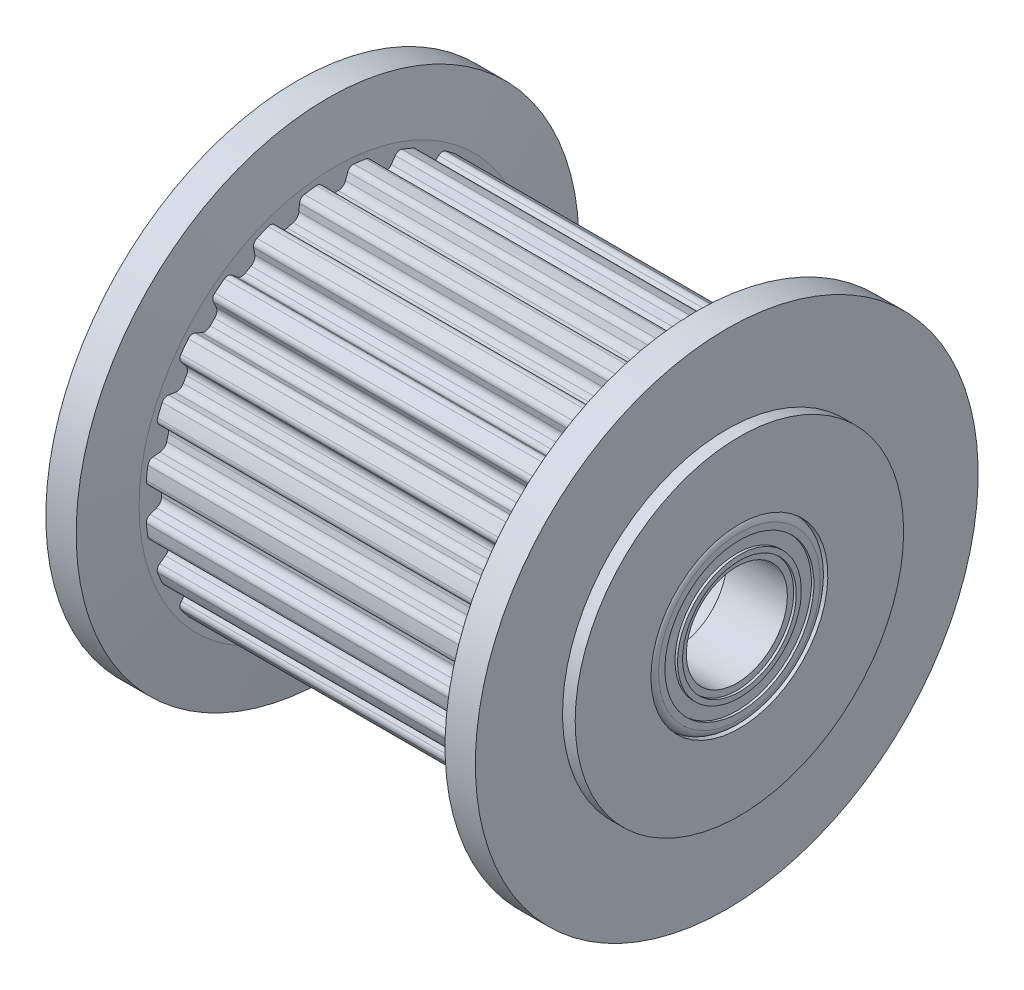
from build123d import *

# Parameters (mm, degrees)
CUT_EXTRUDE_1_DEPTH              = 20.204171422
FILLET_1_R                       = 0.3
FILLET_2_R                       = 0.23
PATTERN_CIRCULAR_1_COUNT         = 24
FILLET_1_OF_PATTERN_CIRCULAR_1_R = 0.3
FILLET_2_OF_PATTERN_CIRCULAR_1_R = 0.23
SKETCH_8_R                       = 2
CUT_EXTRUDE_3_DEPTH              = 23.847428739
SKETCH_9_W                       = 0.1
SKETCH_9_H                       = 0.5


with BuildPart() as part:
    # 草图1 → 旋转1 (revolve)
    with BuildSketch(Plane.XY, mode=Mode.PRIVATE) as revolve_1_sk:
        Polygon((-9, 0), (-9, 6.5), (-7, 6.5), (-7, 7.51), (7, 7.51), (7, 6.5), (9, 6.5), (9, 0), align=None)
    revolve(revolve_1_sk.sketch.rotate(Axis((9, 0, 0), (-1, 0, 0)), 90), axis=Axis((9, 0, 0), (-1, 0, 0)))

    # 草图3 → 切除-拉伸1 (cut, through all)
    with BuildSketch(Plane.ZY.offset(7)):
        with BuildLine():
            Line((-0.563217845, 7.488850757), (-0.335, 6.861827381))
            ThreePointArc((-0.335, 6.861827381), (0, 6.87), (0.335, 6.861827381))
            Line((0.335, 6.861827381), (0.563217845, 7.488850757))
            ThreePointArc((0.563217845, 7.488850757), (0, 7.51), (-0.563217845, 7.488850757))
        make_face()
    cut_extrude_1 = extrude(amount=-CUT_EXTRUDE_1_DEPTH, mode=Mode.SUBTRACT)

    # 圆角1
    fillet_1_edges = [part.edges().sort_by_distance(p)[0] for p in [
        (0, 6.861827381, 0.335),
        (0, 6.861827381, -0.335),
    ]]
    fillet(fillet_1_edges, radius=FILLET_1_R)

    # 圆角2
    fillet_2_edges = [part.edges().sort_by_distance(p)[0] for p in [
        (0, 7.488850757, -0.563217845),
        (0, 7.488850757, 0.563217845),
    ]]
    fillet(fillet_2_edges, radius=FILLET_2_R)

    # 阵列(圆周)1: 切除-拉伸1 ×24 about axis
    pattern_circular_1_axis = Axis((0, 0, 0), (1, 0, 0))
    for i in range(1, PATTERN_CIRCULAR_1_COUNT):
        add(cut_extrude_1.rotate(pattern_circular_1_axis, i * 360 / PATTERN_CIRCULAR_1_COUNT), mode=Mode.SUBTRACT)

    # 圆角1 of 阵列(圆周)1
    fillet_1_of_pattern_circular_1_edges = [part.edges().sort_by_distance(p)[0] for p in [
        (0, 6.541311902, 2.099556762),
        (0, 6.714720662, 1.452386458),
        (0, 5.775016828, 3.721032201),
        (0, 6.110016828, 3.14079518),
        (0, 4.6151639, 5.088925444),
        (0, 5.088925444, 4.6151639),
        (0, 3.14079518, 6.110016828),
        (0, 3.721032201, 5.775016828),
        (0, 1.452386458, 6.714720662),
        (0, 2.099556762, 6.541311902),
        (0, -0.335, 6.861827381),
        (0, 0.335, 6.861827381),
        (0, -2.099556762, 6.541311902),
        (0, -1.452386458, 6.714720662),
        (0, -3.721032201, 5.775016828),
        (0, -3.14079518, 6.110016828),
        (0, -5.088925444, 4.6151639),
        (0, -4.6151639, 5.088925444),
        (0, -6.110016828, 3.14079518),
        (0, -5.775016828, 3.721032201),
        (0, -6.714720662, 1.452386458),
        (0, -6.541311902, 2.099556762),
        (0, -6.861827381, -0.335),
        (0, -6.861827381, 0.335),
        (0, -6.541311902, -2.099556762),
        (0, -6.714720662, -1.452386458),
        (0, -5.775016828, -3.721032201),
        (0, -6.110016828, -3.14079518),
        (0, -4.6151639, -5.088925444),
        (0, -5.088925444, -4.6151639),
        (0, -3.14079518, -6.110016828),
        (0, -3.721032201, -5.775016828),
        (0, -1.452386458, -6.714720662),
        (0, -2.099556762, -6.541311902),
        (0, 0.335, -6.861827381),
        (0, -0.335, -6.861827381),
        (0, 2.099556762, -6.541311902),
        (0, 1.452386458, -6.714720662),
        (0, 3.721032201, -5.775016828),
        (0, 3.14079518, -6.110016828),
        (0, 5.088925444, -4.6151639),
        (0, 4.6151639, -5.088925444),
        (0, 6.110016828, -3.14079518),
        (0, 5.775016828, -3.721032201),
        (0, 6.714720662, -1.452386458),
        (0, 6.541311902, -2.099556762),
    ]]
    fillet(fillet_1_of_pattern_circular_1_edges, radius=FILLET_1_OF_PATTERN_CIRCULAR_1_R)

    # 圆角2 of 阵列(圆周)1
    fillet_2_of_pattern_circular_1_edges = [part.edges().sort_by_distance(p)[0] for p in [
        (0, 7.37944586, 1.394230539),
        (0, 7.08790285, 2.482283864),
        (0, 6.767143923, 3.256664417),
        (0, 6.203926078, 4.23218634),
        (0, 5.693672311, 4.897161996),
        (0, 4.897161996, 5.693672311),
        (0, 4.23218634, 6.203926078),
        (0, 3.256664417, 6.767143923),
        (0, 2.482283864, 7.08790285),
        (0, 1.394230539, 7.37944586),
        (0, 0.563217845, 7.488850757),
        (0, -0.563217845, 7.488850757),
        (0, -1.394230539, 7.37944586),
        (0, -2.482283864, 7.08790285),
        (0, -3.256664417, 6.767143923),
        (0, -4.23218634, 6.203926078),
        (0, -4.897161996, 5.693672311),
        (0, -5.693672311, 4.897161996),
        (0, -6.203926078, 4.23218634),
        (0, -6.767143923, 3.256664417),
        (0, -7.08790285, 2.482283864),
        (0, -7.37944586, 1.394230539),
        (0, -7.488850757, 0.563217845),
        (0, -7.488850757, -0.563217845),
        (0, -7.37944586, -1.394230539),
        (0, -7.08790285, -2.482283864),
        (0, -6.767143923, -3.256664417),
        (0, -6.203926078, -4.23218634),
        (0, -5.693672311, -4.897161996),
        (0, -4.897161996, -5.693672311),
        (0, -4.23218634, -6.203926078),
        (0, -3.256664417, -6.767143923),
        (0, -2.482283864, -7.08790285),
        (0, -1.394230539, -7.37944586),
        (0, -0.563217845, -7.488850757),
        (0, 0.563217845, -7.488850757),
        (0, 1.394230539, -7.37944586),
        (0, 2.482283864, -7.08790285),
        (0, 3.256664417, -6.767143923),
        (0, 4.23218634, -6.203926078),
        (0, 4.897161996, -5.693672311),
        (0, 5.693672311, -4.897161996),
        (0, 6.203926078, -4.23218634),
        (0, 6.767143923, -3.256664417),
        (0, 7.08790285, -2.482283864),
        (0, 7.37944586, -1.394230539),
    ]]
    fillet(fillet_2_of_pattern_circular_1_edges, radius=FILLET_2_OF_PATTERN_CIRCULAR_1_R)

    # 草图5 → 旋转2 (revolve)
    with BuildSketch(Plane.XY, mode=Mode.PRIVATE) as revolve_2_sk:
        Polygon((-8.5, 6.5), (-8.5, 9.95), (-7.3, 9.95), (-7, 7.76), (-7, 6.5), align=None)
        Polygon((8.5, 9.95), (7.3, 9.95), (7, 7.76), (7, 6.5), (8.5, 6.5), align=None)
    revolve(revolve_2_sk.sketch.rotate(Axis((-9, 0, 0), (1, 0, 0)), 180), axis=Axis((-9, 0, 0), (1, 0, 0)))

    # 草图6 → 切除-旋转1 (revolve, cut)
    with BuildSketch(Plane.XY):
        Polygon((-9, 3.5), (-6.5, 3.5), (-6.5, 3), (6.5, 3), (6.5, 3.5), (9, 3.5), (9, 0), (-9, 0), align=None)
    revolve(axis=Axis((9, 0, 0), (-1, 0, 0)), mode=Mode.SUBTRACT)

    # 草图7 → 旋转3 (revolve)
    with BuildSketch(Plane.XY):
        with BuildLine():
            Line((-9, 0), (-6.5, 0))
            Line((-6.5, 0), (-6.5, 3.2))
            ThreePointArc((-6.5, 3.2), (-6.587867966, 3.412132034), (-6.8, 3.5))
            Line((-6.8, 3.5), (-8.7, 3.5))
            ThreePointArc((-8.7, 3.5), (-8.912132034, 3.412132034), (-9, 3.2))
            Line((-9, 3.2), (-9, 0))
        make_face()
        with BuildLine():
            Line((9, 0), (6.5, 0))
            Line((6.5, 0), (6.5, 3.2))
            ThreePointArc((6.5, 3.2), (6.587867966, 3.412132034), (6.8, 3.5))
            Line((6.8, 3.5), (8.7, 3.5))
            ThreePointArc((8.7, 3.5), (8.912132034, 3.412132034), (9, 3.2))
            Line((9, 3.2), (9, 0))
        make_face()
    revolve(axis=Axis((-9, 0, 0), (1, 0, 0)))

    # 草图8 → 切除-拉伸3 (cut, through all)
    with BuildSketch(Plane.ZY.offset(9)):
        with Locations(Location((0, 0, 0), (0, 0, 270))):
            Circle(SKETCH_8_R)
    extrude(amount=-CUT_EXTRUDE_3_DEPTH, mode=Mode.SUBTRACT)

    # 草图9 → 切除-旋转2 (revolve, cut)
    with BuildSketch(Plane.XY, mode=Mode.PRIVATE) as cut_revolve_2_sk:
        with Locations((-8.95, 2)):
            Rectangle(SKETCH_9_W, SKETCH_9_H)
        with Locations((8.95, 2)):
            Rectangle(SKETCH_9_W, SKETCH_9_H)
        with Locations((-8.95, 2.7)):
            Rectangle(SKETCH_9_W, SKETCH_9_H)
        with Locations((8.95, 2.7)):
            Rectangle(SKETCH_9_W, SKETCH_9_H)
    revolve(cut_revolve_2_sk.sketch.rotate(Axis((-9, 0, 0), (1, 0, 0)), 180), axis=Axis((-9, 0, 0), (1, 0, 0)), mode=Mode.SUBTRACT)


solid = part.part
